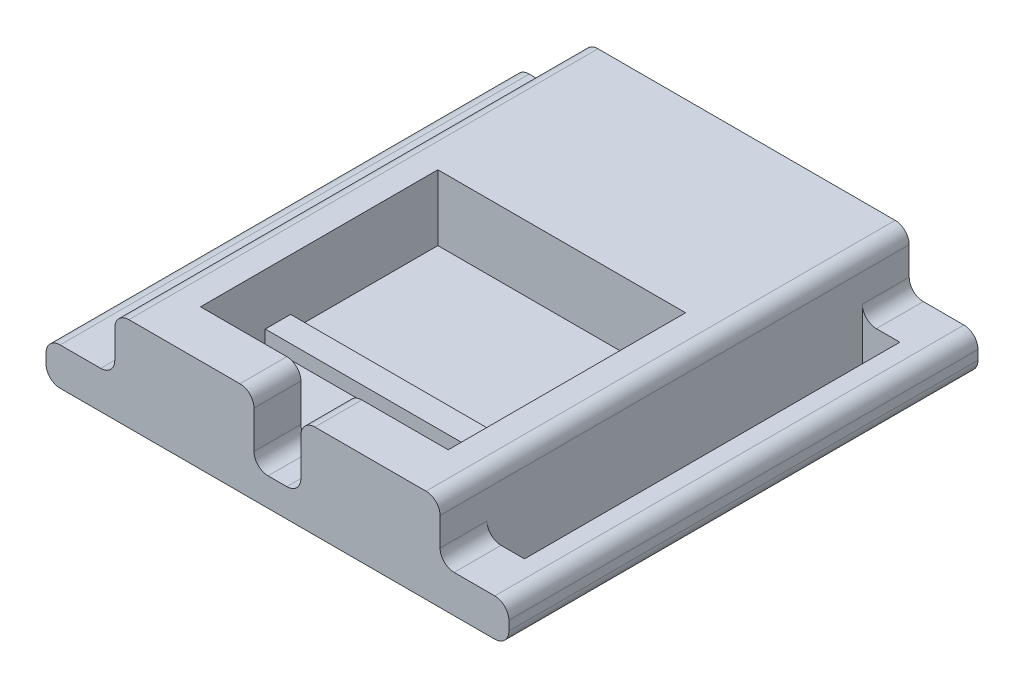
from build123d import *

# Parameters (mm, degrees)
SKETCH1_W            = 49.332
SKETCH1_H            = 50
SKETCH1_W_2          = 4
SKETCH1_H_2          = 40
BOSS_EXTRUDE1_DEPTH  = 4
SKETCH2_W            = 4.134
SKETCH2_H            = 50
BOSS_EXTRUDE2_DEPTH  = 6
SKETCH8_W            = 4.134
SKETCH8_H            = 50
BOSS_EXTRUDE6_DEPTH  = 6
SKETCH9_W            = 26.398
SKETCH9_H            = 19.7
BOSS_EXTRUDE7_DEPTH  = 6
SKETCH10_W           = 26.398
SKETCH10_H           = 5
BOSS_EXTRUDE8_DEPTH  = 6
SKETCH11_W           = 5
SKETCH11_H           = 5
CUT_EXTRUDE1_DEPTH   = 7
FILLET9_R            = 1.5
FILLET10_R           = 1.5
FILLET13_R           = 1.5
FILLET14_R           = 1.5
FILLET15_R           = 1.5
SKETCH12_W           = 26.398
SKETCH12_H           = 25.3
CUT_EXTRUDE2_DEPTH   = 1
SKETCH13_W           = 26.398
SKETCH13_H           = 2.7
BOSS_EXTRUDE10_DEPTH = 1.5
FILLET18_R           = 1.5
FILLET19_R           = 1.5


with BuildPart() as part:
    # Sketch1 → Boss-Extrude1 (new body)
    with BuildSketch(Plane(origin=(0, 0, 0), x_dir=(1, 0, 0), z_dir=(0, 1, 0))):
        with Locations((7.133329328, 13.494184872)):
            Rectangle(SKETCH1_W, SKETCH1_H)
        with Locations((26.466329328, 13.494184872)):
            Rectangle(SKETCH1_W_2, SKETCH1_H_2, mode=Mode.SUBTRACT)
        with Locations((-12.199670672, 13.494184872)):
            Rectangle(SKETCH1_W_2, SKETCH1_H_2, mode=Mode.SUBTRACT)
    extrude(amount=BOSS_EXTRUDE1_DEPTH)

    # Sketch2 → Boss-Extrude2 (add)
    with BuildSketch(Plane(origin=(0, 4, 0), x_dir=(1, 0, 0), z_dir=(0, 1, 0))):
        with Locations((-8.132670672, 13.494184872)):
            Rectangle(SKETCH2_W, SKETCH2_H)
    extrude(amount=BOSS_EXTRUDE2_DEPTH)

    # Sketch8 → Boss-Extrude6 (add)
    with BuildSketch(Plane(origin=(0, 4, 0), x_dir=(1, 0, 0), z_dir=(0, 1, 0))):
        with Locations((22.399329328, 13.494184872)):
            Rectangle(SKETCH8_W, SKETCH8_H)
    extrude(amount=BOSS_EXTRUDE6_DEPTH)

    # Sketch9 → Boss-Extrude7 (add)
    with BuildSketch(Plane(origin=(0, 4, 0), x_dir=(1, 0, 0), z_dir=(0, 1, 0))):
        with Locations((7.133329328, 28.644184872)):
            Rectangle(SKETCH9_W, SKETCH9_H)
    extrude(amount=BOSS_EXTRUDE7_DEPTH)

    # Sketch10 → Boss-Extrude8 (add)
    with BuildSketch(Plane(origin=(0, 4, 0), x_dir=(1, 0, 0), z_dir=(0, 1, 0))):
        with Locations((7.133329328, -9.005815128)):
            Rectangle(SKETCH10_W, SKETCH10_H)
    extrude(amount=BOSS_EXTRUDE8_DEPTH)

    # Sketch11 → Cut-Extrude1 (cut)
    with BuildSketch(Plane(origin=(0, 10, 0), x_dir=(1, 0, 0), z_dir=(0, 1, 0))):
        with Locations((7.134329328, -9.005815128)):
            Rectangle(SKETCH11_W, SKETCH11_H)
    extrude(amount=-CUT_EXTRUDE1_DEPTH, mode=Mode.SUBTRACT)

    # Fillet9
    fillet9_edges = [part.edges().sort_by_distance(p)[0] for p in [
        (-10.199670672, 4, 9.005815128),
    ]]
    fillet(fillet9_edges, radius=FILLET9_R)

    # Fillet10
    fillet10_edges = [part.edges().sort_by_distance(p)[0] for p in [
        (-10.199670672, 4, -35.994184872),
    ]]
    fillet(fillet10_edges, radius=FILLET10_R)

    # Fillet13
    fillet13_edges = [part.edges().sort_by_distance(p)[0] for p in [
        (24.466329328, 4, -35.994184872),
    ]]
    fillet(fillet13_edges, radius=FILLET13_R)

    # Fillet14
    fillet14_edges = [part.edges().sort_by_distance(p)[0] for p in [
        (24.466329328, 4, 9.005815128),
    ]]
    fillet(fillet14_edges, radius=FILLET14_R)

    # Fillet15
    fillet15_edges = [part.edges().sort_by_distance(p)[0] for p in [
        (4.634329328, 10, 9.005815128),
        (9.634329328, 10, 9.005815128),
        (31.799329328, 4, -13.494184872),
        (-10.199670672, 10, -13.494184872),
        (-17.532670672, 4, -13.494184872),
        (31.799329328, 0, -13.494184872),
        (-17.532670672, 0, -13.494184872),
        (24.466329328, 10, -13.494184872),
    ]]
    fillet(fillet15_edges, radius=FILLET15_R)

    # Sketch12 → Cut-Extrude2 (cut)
    with BuildSketch(Plane(origin=(0, 4, 0), x_dir=(1, 0, 0), z_dir=(0, 1, 0))):
        with Locations((7.133329328, 6.144184872)):
            Rectangle(SKETCH12_W, SKETCH12_H)
    extrude(amount=-CUT_EXTRUDE2_DEPTH, mode=Mode.SUBTRACT)

    # Sketch13 → Boss-Extrude10 (add)
    with BuildSketch(Plane(origin=(0, 3, 0), x_dir=(1, 0, 0), z_dir=(0, 1, 0))):
        with Locations((7.133329328, 1.744184872)):
            Rectangle(SKETCH13_W, SKETCH13_H)
    extrude(amount=BOSS_EXTRUDE10_DEPTH)

    # Fillet18
    fillet18_edges = [part.edges().sort_by_distance(p)[0] for p in [
        (4.634329328, 3, 9.005815128),
    ]]
    fillet(fillet18_edges, radius=FILLET18_R)

    # Fillet19
    fillet19_edges = [part.edges().sort_by_distance(p)[0] for p in [
        (9.634329328, 3, 9.005815128),
    ]]
    fillet(fillet19_edges, radius=FILLET19_R)


solid = part.part
